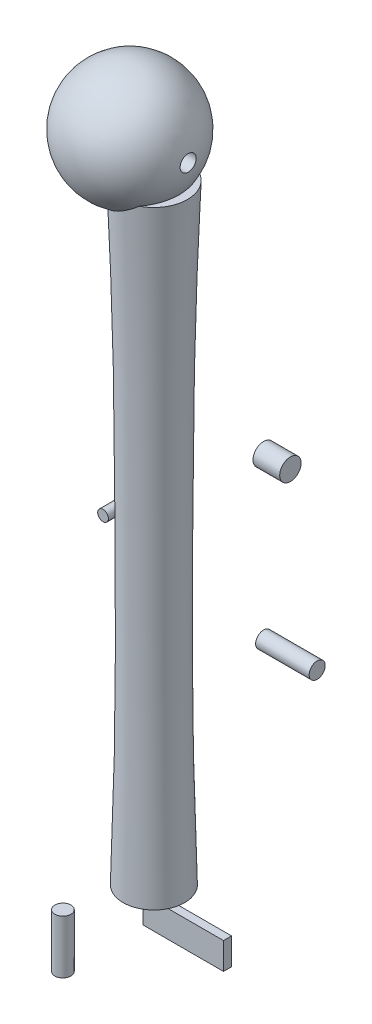
from build123d import *

# Parameters (mm, degrees)
SKETCH3_W          = 30
SKETCH3_H          = 10
PLACAFRONTAL_DEPTH = 3
SKETCH4_R          = 4
CILLATERAL_DEPTH   = 10
SKETCH5_R          = 3
CILSUPERIOR_DEPTH  = 20
SKETCH6_W          = 20
SKETCH6_H          = 3
SKETCH7_W          = 15
SKETCH7_H          = 2
SKETCH8_R          = 3
TALADRO_DEPTH      = 1000


with BuildPart() as part:
    # Sketch1 → Diafisis (revolve)
    with BuildSketch(Plane.XY):
        with BuildLine():
            Line((20.5, -240), (9, -240))
            Line((9, -240), (9, -12))
            Line((9, -12), (21.5, -12))
            add(Edge.make_bspline(
                [(21.5, -12), (21.019671529, -24.665559348), (19.654971688, -60.650698391), (19.260523811, -123.331340783), (18.969556139, -186.677719017), (20.117329868, -226.667368332), (20.5, -240)],
                knots=[0, 0, 0, 0, 0.166734358, 0.473722391, 0.824537958, 1, 1, 1, 1], degree=3))
        make_face()
    revolve(axis=Axis((9, -244, 0), (0, 1, 0)))

    # Sketch2 → Cabeza (revolve)
    with BuildSketch(Plane.XY):
        with BuildLine():
            Line((0, -22), (0, 22))
            ThreePointArc((0, 22), (22, 0), (0, -22))
        make_face()
    revolve(axis=Axis((0, -26, 0), (0, 1, 0)))

    # Sketch8 → Taladro (cut, symmetric)
    with BuildSketch(Plane(origin=(0, 0, 0), x_dir=(0, 0, -1), z_dir=(1, 0, 0))):
        Circle(SKETCH8_R)
    extrude(amount=TALADRO_DEPTH, both=True, mode=Mode.SUBTRACT)


with BuildPart() as body_2:
    # Sketch3 → PlacaFrontal (new body)
    with BuildSketch(Plane.XY.offset(-8)):
        with Locations((15, -255)):
            Rectangle(SKETCH3_W, SKETCH3_H)
    extrude(amount=PLACAFRONTAL_DEPTH)


with BuildPart() as body_3:
    # Sketch4 → CilLateral (new body)
    with BuildSketch(Plane(origin=(30, 0, 0), x_dir=(0, 0, -1), z_dir=(1, 0, 0))):
        with Locations((20, -100)):
            Circle(SKETCH4_R)
    extrude(amount=CILLATERAL_DEPTH)


with BuildPart() as body_4:
    # Sketch5 → CilSuperior (new body)
    with BuildSketch(Plane(origin=(0, -300, 0), x_dir=(1, 0, 0), z_dir=(0, 1, 0))):
        with Locations(Location((-40, 15, 0), (0, 0, 270))):
            Circle(SKETCH5_R)
    extrude(amount=CILSUPERIOR_DEPTH)


with BuildPart() as body_5:
    # Sketch6 → RevX (revolve)
    with BuildSketch(Plane.XY.offset(-10), mode=Mode.PRIVATE) as revx_sk:
        with Locations((50, -148.5)):
            Rectangle(SKETCH6_W, SKETCH6_H)
    revolve(revx_sk.sketch.rotate(Axis((36, -150, -10), (1, 0, 0)), 90), axis=Axis((36, -150, -10), (1, 0, 0)))


with BuildPart() as body_6:
    # Sketch7 → RevA (revolve)
    with BuildSketch(Plane(origin=(-30, 0, 0), x_dir=(0, 0, -1), z_dir=(1, 0, 0)), mode=Mode.PRIVATE) as reva_sk:
        with Locations((27.5, -149)):
            Rectangle(SKETCH7_W, SKETCH7_H)
    revolve(reva_sk.sketch.rotate(Axis((-30, -150, -16), (0, 0, -1)), 90), axis=Axis((-30, -150, -16), (0, 0, -1)))


solid = Compound([part.part, body_2.part, body_3.part, body_4.part, body_5.part, body_6.part])
